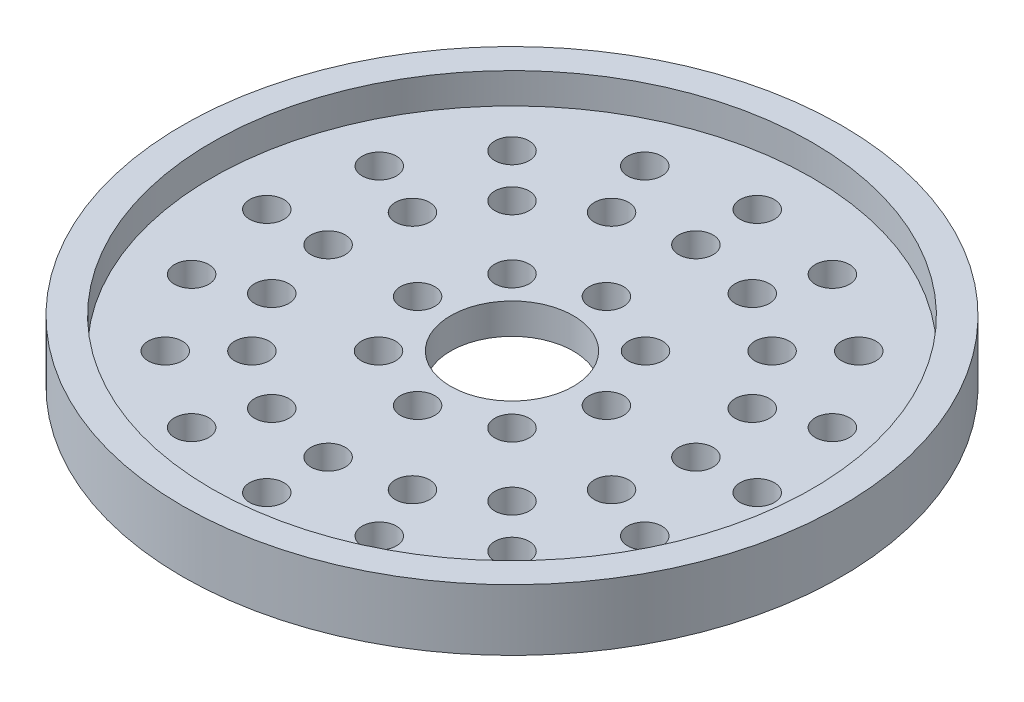
from build123d import *

# Parameters (mm, degrees)
SKETCH1_R           = 34.1376
BOSS_EXTRUDE1_DEPTH = 6.35
SKETCH2_R           = 31.0896
CUT_EXTRUDE3_DEPTH  = 3.175
SKETCH3_R           = 6.35
CUT_EXTRUDE4_DEPTH  = 3.175
SKETCH7_R           = 1.778
CUT_EXTRUDE5_DEPTH  = 3.175


with BuildPart() as part:
    # Sketch1 → Boss-Extrude1 (new body)
    with BuildSketch(Plane(origin=(0, 0, 0), x_dir=(1, 0, 0), z_dir=(0, 1, 0))):
        with Locations(Location((0, 0, 0), (0, 0, 270))):
            Circle(SKETCH1_R)
    extrude(amount=BOSS_EXTRUDE1_DEPTH)

    # Sketch2 → Cut-Extrude3 (cut)
    with BuildSketch(Plane(origin=(0, 6.35, 0), x_dir=(1, 0, 0), z_dir=(0, 1, 0))):
        with Locations(Location((0, 0, 0), (0, 0, 270))):
            Circle(SKETCH2_R)
    extrude(amount=-CUT_EXTRUDE3_DEPTH, mode=Mode.SUBTRACT)

    # Sketch3 → Cut-Extrude4 (cut)
    with BuildSketch(Plane(origin=(0, 3.175, 0), x_dir=(1, 0, 0), z_dir=(0, 1, 0))):
        with Locations(Location((0, 0, 0), (0, 0, 270))):
            Circle(SKETCH3_R)
    extrude(amount=-CUT_EXTRUDE4_DEPTH, mode=Mode.SUBTRACT)

    # Sketch7 → Cut-Extrude5 (cut)
    with BuildSketch(Plane(origin=(0, 3.175, 0), x_dir=(1, 0, 0), z_dir=(0, 1, 0))):
        with Locations(Location((0, 25.4, 0), (0, 0, 270))):
            Circle(SKETCH7_R)
        with Locations(Location((-9.720159182, 23.466540126, 0), (0, 0, 270))):
            Circle(SKETCH7_R)
        with Locations(Location((-17.960512242, 17.960512242, 0), (0, 0, 270))):
            Circle(SKETCH7_R)
        with Locations(Location((-23.466540126, 9.720159182, 0), (0, 0, 270))):
            Circle(SKETCH7_R)
        with Locations(Location((-25.4, 0, 0), (0, 0, 270))):
            Circle(SKETCH7_R)
        with Locations(Location((-23.466540126, -9.720159182, 0), (0, 0, 270))):
            Circle(SKETCH7_R)
        with Locations(Location((-17.960512242, -17.960512242, 0), (0, 0, 270))):
            Circle(SKETCH7_R)
        with Locations(Location((-9.720159182, -23.466540126, 0), (0, 0, 270))):
            Circle(SKETCH7_R)
        with Locations(Location((0, -25.4, 0), (0, 0, 270))):
            Circle(SKETCH7_R)
        with Locations(Location((9.720159182, -23.466540126, 0), (0, 0, 270))):
            Circle(SKETCH7_R)
        with Locations(Location((17.960512242, -17.960512242, 0), (0, 0, 270))):
            Circle(SKETCH7_R)
        with Locations(Location((23.466540126, -9.720159182, 0), (0, 0, 270))):
            Circle(SKETCH7_R)
        with Locations(Location((25.4, 0, 0), (0, 0, 270))):
            Circle(SKETCH7_R)
        with Locations(Location((23.466540126, 9.720159182, 0), (0, 0, 270))):
            Circle(SKETCH7_R)
        with Locations(Location((17.960512242, 17.960512242, 0), (0, 0, 270))):
            Circle(SKETCH7_R)
        with Locations(Location((9.720159182, 23.466540126, 0), (0, 0, 270))):
            Circle(SKETCH7_R)
        with Locations(Location((7.290119387, 17.599905094, 0), (0, 0, 270))):
            Circle(SKETCH7_R)
        with Locations(Location((13.470384182, 13.470384182, 0), (0, 0, 270))):
            Circle(SKETCH7_R)
        with Locations(Location((17.599905094, 7.290119387, 0), (0, 0, 270))):
            Circle(SKETCH7_R)
        with Locations(Location((19.05, 0, 0), (0, 0, 270))):
            Circle(SKETCH7_R)
        with Locations(Location((17.599905094, -7.290119387, 0), (0, 0, 270))):
            Circle(SKETCH7_R)
        with Locations(Location((13.470384182, -13.470384182, 0), (0, 0, 270))):
            Circle(SKETCH7_R)
        with Locations(Location((7.290119387, -17.599905094, 0), (0, 0, 270))):
            Circle(SKETCH7_R)
        with Locations(Location((0, -19.05, 0), (0, 0, 270))):
            Circle(SKETCH7_R)
        with Locations(Location((-7.290119387, -17.599905094, 0), (0, 0, 270))):
            Circle(SKETCH7_R)
        with Locations(Location((-13.470384182, -13.470384182, 0), (0, 0, 270))):
            Circle(SKETCH7_R)
        with Locations(Location((-17.599905094, -7.290119387, 0), (0, 0, 270))):
            Circle(SKETCH7_R)
        with Locations(Location((-19.05, 0, 0), (0, 0, 270))):
            Circle(SKETCH7_R)
        with Locations(Location((-17.599905094, 7.290119387, 0), (0, 0, 270))):
            Circle(SKETCH7_R)
        with Locations(Location((-13.470384182, 13.470384182, 0), (0, 0, 270))):
            Circle(SKETCH7_R)
        with Locations(Location((-7.290119387, 17.599905094, 0), (0, 0, 270))):
            Circle(SKETCH7_R)
        with Locations(Location((0, 19.05, 0), (0, 0, 270))):
            Circle(SKETCH7_R)
        with Locations(Location((0, 9.779, 0), (0, 0, 270))):
            Circle(SKETCH7_R)
        with Locations(Location((-6.914797213, 6.914797213, 0), (0, 0, 270))):
            Circle(SKETCH7_R)
        with Locations(Location((-9.779, 0, 0), (0, 0, 270))):
            Circle(SKETCH7_R)
        with Locations(Location((-6.914797213, -6.914797213, 0), (0, 0, 270))):
            Circle(SKETCH7_R)
        with Locations(Location((0, -9.779, 0), (0, 0, 270))):
            Circle(SKETCH7_R)
        with Locations(Location((6.914797213, -6.914797213, 0), (0, 0, 270))):
            Circle(SKETCH7_R)
        with Locations(Location((9.779, 0, 0), (0, 0, 270))):
            Circle(SKETCH7_R)
        with Locations(Location((6.914797213, 6.914797213, 0), (0, 0, 270))):
            Circle(SKETCH7_R)
    extrude(amount=-CUT_EXTRUDE5_DEPTH, mode=Mode.SUBTRACT)


solid = part.part
